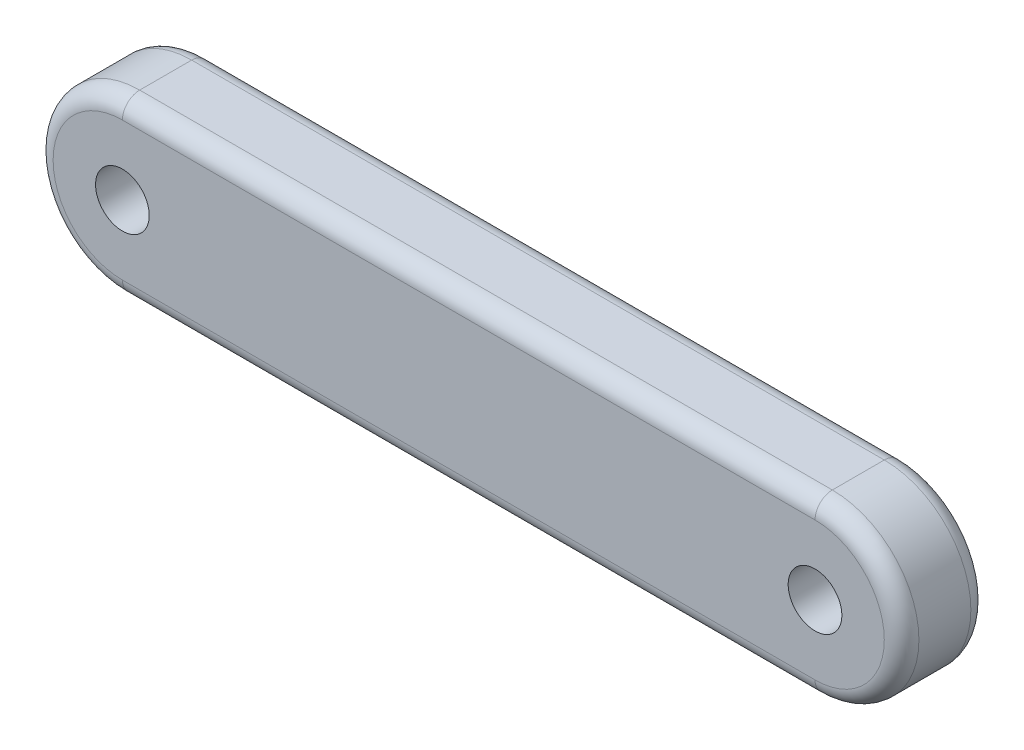
from build123d import *

# Parameters (mm, degrees)
BOSS_EXTRUDE1_DEPTH            = 12.7
FILLET1_R                      = 2.54
F_97_0_31_DIAMETER_HOLE1_D     = 7.874
F_97_0_31_DIAMETER_HOLE1_DEPTH = 25.4
F_97_0_31_DIAMETER_HOLE1_TIP   = 2.365588257


with BuildPart() as part:
    # Sketch1 → Boss-Extrude1 (new body)
    with BuildSketch(Plane.XY):
        with BuildLine():
            Line((0, 12.7), (101.6, 12.7))
            ThreePointArc((101.6, 12.7), (114.3, 0), (101.6, -12.7))
            Line((101.6, -12.7), (0, -12.7))
            ThreePointArc((0, -12.7), (-12.7, 0), (0, 12.7))
        make_face()
    extrude(amount=BOSS_EXTRUDE1_DEPTH)

    # Fillet1
    fillet1_edges = [part.edges().sort_by_distance(p)[0] for p in [
        (114.3, 0, 12.7),
        (50.8, 12.7, 12.7),
        (-12.7, 0, 12.7),
        (50.8, 12.7, 0),
        (114.3, 0, 0),
        (50.8, -12.7, 0),
        (-12.7, 0, 0),
        (50.8, -12.7, 12.7),
    ]]
    fillet(fillet1_edges, radius=FILLET1_R)

    # #97 (0.31) Diameter Hole1
    with Locations(Plane.XY.offset(12.7)):
        with Locations((0, 0), (101.6, 0)):
            Hole(F_97_0_31_DIAMETER_HOLE1_D / 2, depth=F_97_0_31_DIAMETER_HOLE1_DEPTH)
            with Locations((0, 0, -(F_97_0_31_DIAMETER_HOLE1_DEPTH + F_97_0_31_DIAMETER_HOLE1_TIP / 2))):  # 118° drill point
                Cone(0, F_97_0_31_DIAMETER_HOLE1_D / 2, F_97_0_31_DIAMETER_HOLE1_TIP, mode=Mode.SUBTRACT)


solid = part.part
